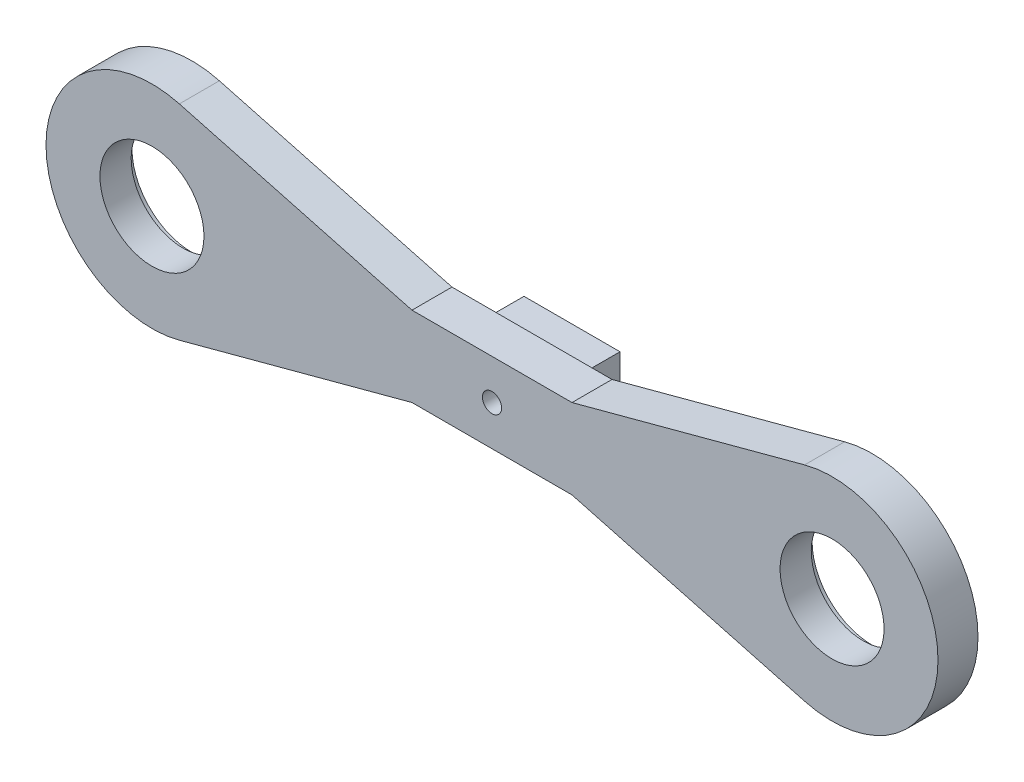
from build123d import *

# Parameters (mm, degrees)
SKETCH_1_R          = 6.5
EXTRUDE_1_DEPTH     = 5
SKETCH_2_W          = 12
SKETCH_2_H          = 7
SKETCH_2_W_2        = 10
SKETCH_2_H_2        = 5
EXTRUDE_1_2_DEPTH   = 5
SKETCH_3_R          = 1.2
CUT_EXTRUDE_1_DEPTH = 5
SKETCH_4_R          = 7.5
CUT_EXTRUDE_2_DEPTH = 1.1


with BuildPart() as part:
    # 草图1 → Extrude 1 (new body)
    with BuildSketch(Plane.XY):
        with BuildLine():
            Line((-10, 5), (10, 5))
            Line((10, 5), (39.072912811, 12.790063509))
            ThreePointArc((39.072912811, 12.790063509), (55.741248097, 0), (39.072912811, -12.790063509))
            Line((39.072912811, -12.790063509), (10, -5))
            Line((10, -5), (-10, -5))
            Line((-10, -5), (-39.072912811, -12.790063509))
            ThreePointArc((-39.072912811, -12.790063509), (-55.741248097, 0), (-39.072912811, 12.790063509))
            Line((-39.072912811, 12.790063509), (-10, 5))
        make_face()
        with Locations((-42.5, 0)):
            Circle(SKETCH_1_R, mode=Mode.SUBTRACT)
        with Locations((42.5, 0)):
            Circle(SKETCH_1_R, mode=Mode.SUBTRACT)
    extrude(amount=EXTRUDE_1_DEPTH)

    # 草图2 → Extrude 1 2 (add)
    with BuildSketch(Plane(origin=(0, 0, 0), x_dir=(-1, 0, 0), z_dir=(0, 0, -1))):
        Rectangle(SKETCH_2_W, SKETCH_2_H)
        Rectangle(SKETCH_2_W_2, SKETCH_2_H_2, mode=Mode.SUBTRACT)
    extrude(amount=EXTRUDE_1_2_DEPTH)

    # 草图3 → 切除-拉伸1 (cut)
    with BuildSketch(Plane(origin=(0, 0, 0), x_dir=(-1, 0, 0), z_dir=(0, 0, -1))):
        Circle(SKETCH_3_R)
    extrude(amount=-CUT_EXTRUDE_1_DEPTH, mode=Mode.SUBTRACT)

    # 草图4 → 切除-拉伸2 (cut)
    with BuildSketch(Plane(origin=(0, 0, 0), x_dir=(-1, 0, 0), z_dir=(0, 0, -1))):
        with Locations((-42.5, 0)):
            Circle(SKETCH_4_R)
        with Locations((42.5, 0)):
            Circle(SKETCH_4_R)
    extrude(amount=-CUT_EXTRUDE_2_DEPTH, mode=Mode.SUBTRACT)


solid = part.part
